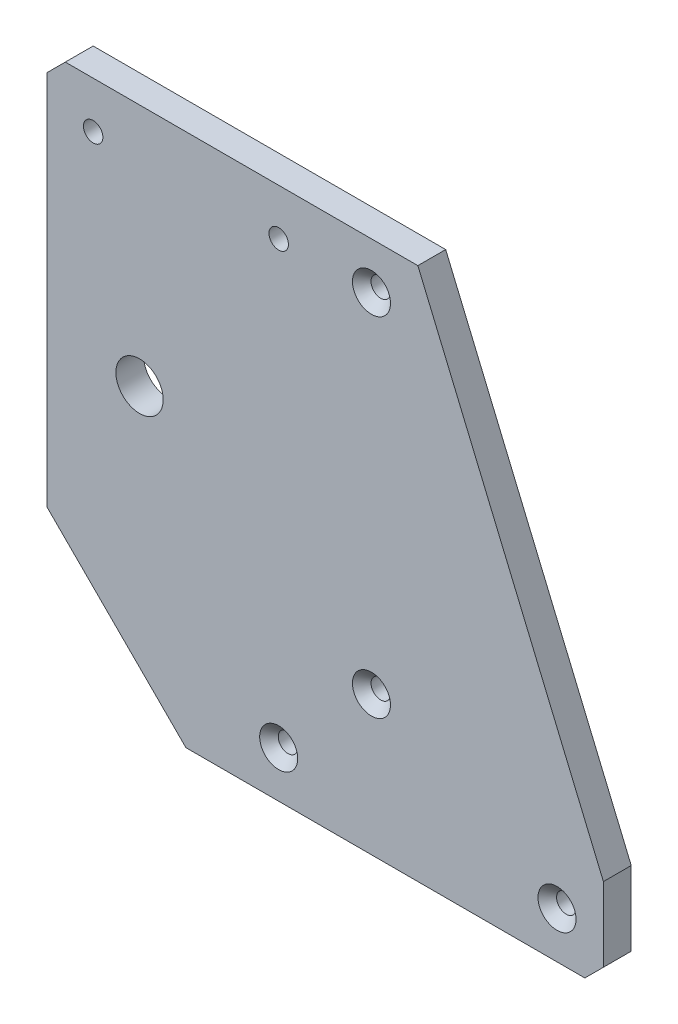
from build123d import *

# Parameters (mm, degrees)
SKETCH_1_R          = 5.1
EXTRUDE_1_DEPTH     = 3
SKETCH_2_R          = 2.1
CUT_EXTRUDE_1_DEPTH = 119.077305186
CHAMFER_1_SIZE      = 30
CHAMFER_3_SIZE      = 4
CHAMFER_2_SIZE      = 2


with BuildPart() as part:
    # 草图1 → 凸台-拉伸1 (new, symmetric)
    with BuildSketch(Plane.XY):
        Polygon((-20, 52.5), (-20, -62.5), (100, -62.5), (100, -42.5), (60, 52.5), align=None)
        Circle(SKETCH_1_R, mode=Mode.SUBTRACT)
    extrude(amount=EXTRUDE_1_DEPTH, both=True)

    # 草图2 → 切除-拉伸1 (cut, through all)
    with BuildSketch(Plane.XY.offset(3)):
        with Locations((-10, 42.5)):
            Circle(SKETCH_2_R)
        with Locations((30, 42.5)):
            Circle(SKETCH_2_R)
        with Locations((50, 42.5)):
            Circle(SKETCH_2_R)
        with Locations((50, -32.5)):
            Circle(SKETCH_2_R)
        with Locations((30, -52.5)):
            Circle(SKETCH_2_R)
        with Locations((90, -52.5)):
            Circle(SKETCH_2_R)
    extrude(amount=-CUT_EXTRUDE_1_DEPTH, mode=Mode.SUBTRACT)

    # 倒角1
    chamfer_1_edges = [part.edges().sort_by_distance(p)[0] for p in [
        (-20, -62.5, 0),
    ]]
    chamfer(chamfer_1_edges, length=CHAMFER_1_SIZE)

    # 倒角3
    chamfer_3_edges = [part.edges().sort_by_distance(p)[0] for p in [
        (100, -62.5, 0),
        (-20, 52.5, 0),
    ]]
    chamfer(chamfer_3_edges, length=CHAMFER_3_SIZE)

    # 倒角2
    chamfer_2_edges = [part.edges().sort_by_distance(p)[0] for p in [
        (47.9, 42.5, 3),
        (47.9, -32.5, 3),
        (27.9, -52.5, 3),
        (87.9, -52.5, 3),
    ]]
    chamfer(chamfer_2_edges, length=CHAMFER_2_SIZE)


solid = part.part
